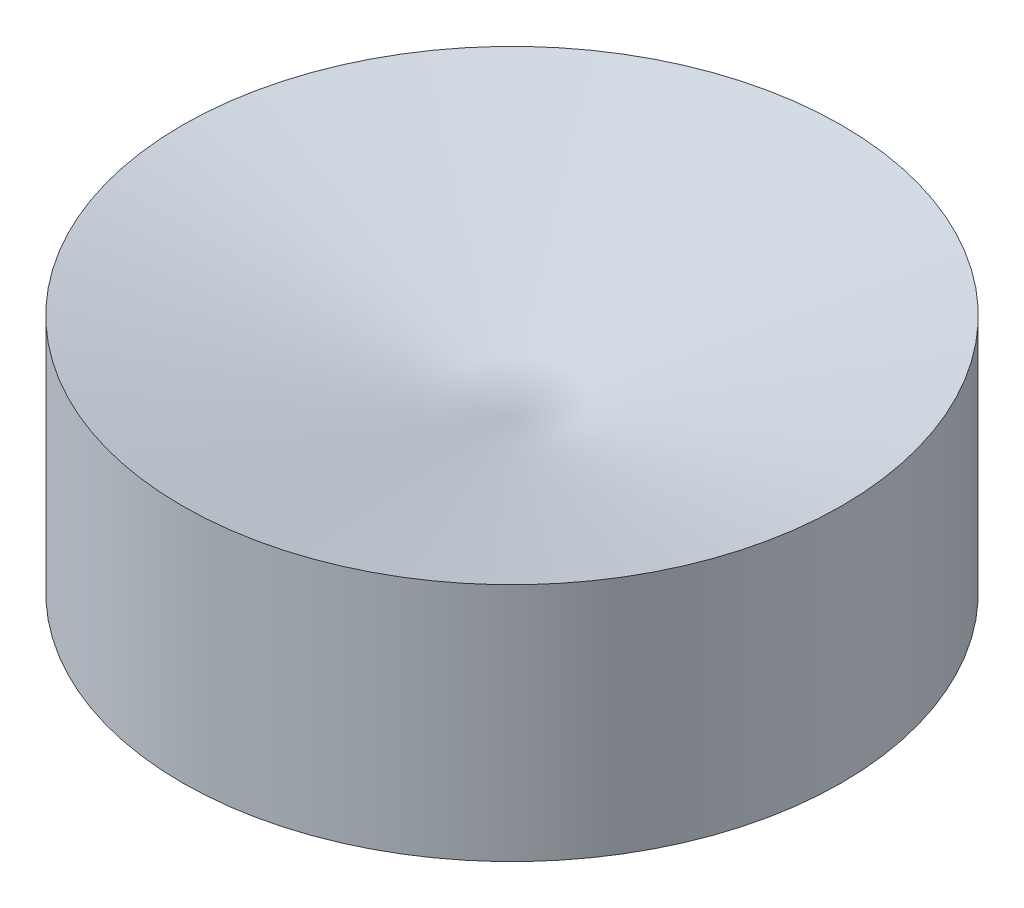
from build123d import *


with BuildPart() as part:
    # Sketch1 → Revolve1 (revolve)
    with BuildSketch(Plane(origin=(0, 0, 0), x_dir=(0, 0, -1), z_dir=(1, 0, 0))):
        Polygon((-55, 20), (-55, -20), (0, -20), (0, 5.262794416), align=None)
    revolve(axis=Axis((0, 43.071073477, 0), (0, -1, 0)))


solid = part.part
